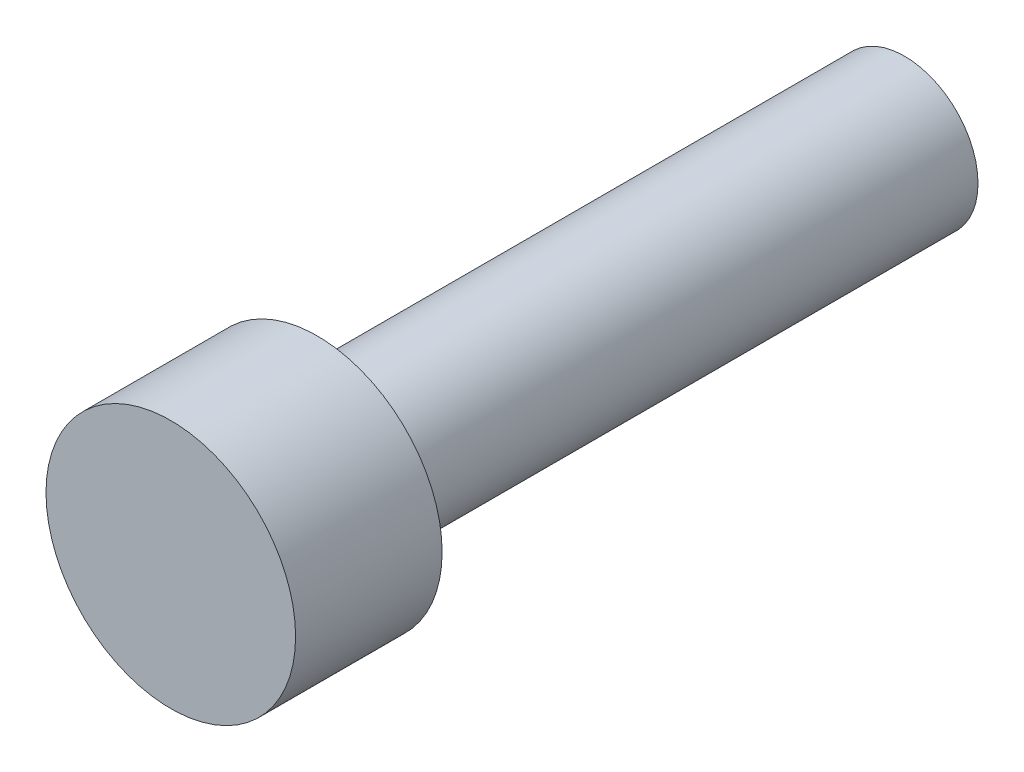
from build123d import *

# Parameters (mm, degrees)
SKETCH_1_R      = 2.5
EXTRUDE_1_DEPTH = 20
SKETCH_2_R      = 4.25
EXTRUDE_2_DEPTH = 4.99


with BuildPart() as part:
    # 草图1 → 凸台-拉伸1 (new body)
    with BuildSketch(Plane.XY):
        Circle(SKETCH_1_R)
    extrude(amount=-EXTRUDE_1_DEPTH)

    # 草图2 → 凸台-拉伸2 (add)
    with BuildSketch(Plane.XY):
        Circle(SKETCH_2_R)
    extrude(amount=EXTRUDE_2_DEPTH)


solid = part.part
